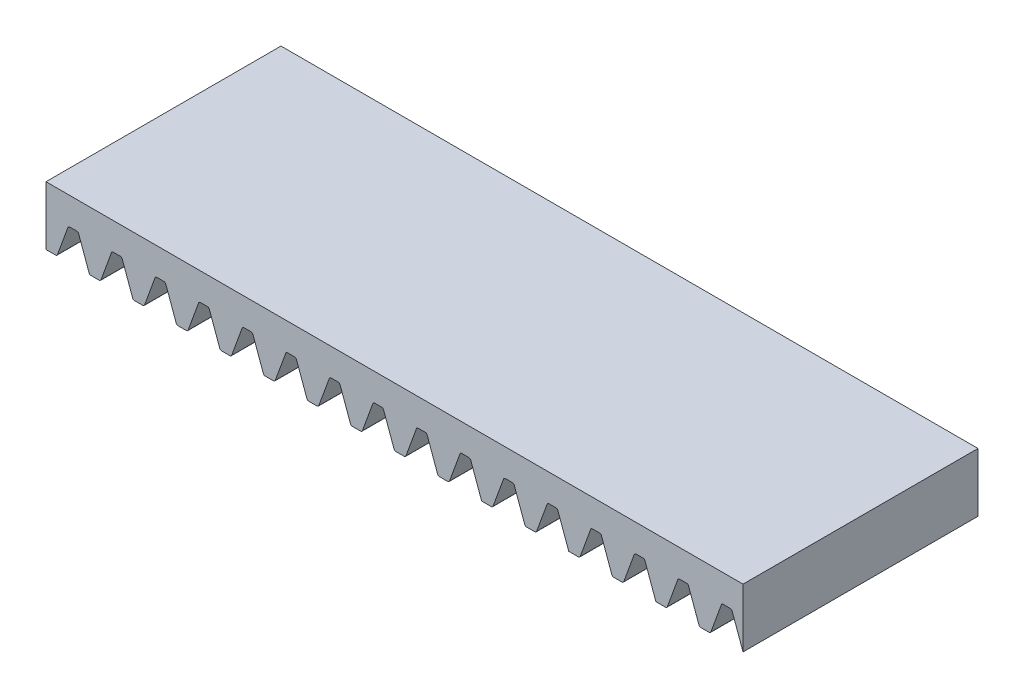
from build123d import *

# Parameters (mm, degrees)
BOSS_EXTRUDE1_DEPTH = 60
FILLET1_R           = 0.5
LPATTERN1_COUNT     = 8
LPATTERN1_PITCH     = 22.2470475
FILLET2_R           = 0.5


with BuildPart() as part:
    # Sketch1 → Boss-Extrude1 (new body)
    with BuildSketch(Plane.XY):
        Polygon((0, 0), (2.8, 0), (5.711761874, 8), (8.211761874, 8), (11.123523748, 0), (13.923523748, 0), (16.835285622, 8), (19.335285622, 8), (22.247047497, 0), (22.247047497, 15), (0, 15), align=None)
    extrude(amount=BOSS_EXTRUDE1_DEPTH)

    # Fillet1
    fillet1_edges = [part.edges().sort_by_distance(p)[0] for p in [
        (19.335285622, 8, 30),
        (16.835285622, 8, 30),
        (13.923523748, 0, 30),
        (2.8, 0, 30),
        (11.123523748, 0, 30),
        (8.211761874, 8, 30),
        (5.711761874, 8, 30),
    ]]
    fillet(fillet1_edges, radius=FILLET1_R)


with BuildPart() as lpattern1_1:
    # LPattern1: pattern copy
    add(part.part.moved(Location(Vector(1, 0, 0) * (1 * LPATTERN1_PITCH))))


with BuildPart() as lpattern1_2:
    # LPattern1: pattern copy
    add(part.part.moved(Location(Vector(1, 0, 0) * (2 * LPATTERN1_PITCH))))


with BuildPart() as lpattern1_3:
    # LPattern1: pattern copy
    add(part.part.moved(Location(Vector(1, 0, 0) * (3 * LPATTERN1_PITCH))))


with BuildPart() as lpattern1_4:
    # LPattern1: pattern copy
    add(part.part.moved(Location(Vector(1, 0, 0) * (4 * LPATTERN1_PITCH))))


with BuildPart() as lpattern1_5:
    # LPattern1: pattern copy
    add(part.part.moved(Location(Vector(1, 0, 0) * (5 * LPATTERN1_PITCH))))


with BuildPart() as lpattern1_6:
    # LPattern1: pattern copy
    add(part.part.moved(Location(Vector(1, 0, 0) * (6 * LPATTERN1_PITCH))))


with BuildPart() as lpattern1_7:
    # LPattern1: pattern copy
    add(part.part.moved(Location(Vector(1, 0, 0) * (7 * LPATTERN1_PITCH))))


with BuildPart() as part_1:
    add(part.part)

    # Combine1: union LPattern1_1, LPattern1_2, LPattern1_3, LPattern1_4, LPattern1_5, LPattern1_6, LPattern1_7
    add(lpattern1_1.part)
    add(lpattern1_2.part)
    add(lpattern1_3.part)
    add(lpattern1_4.part)
    add(lpattern1_5.part)
    add(lpattern1_6.part)
    add(lpattern1_7.part)

    # Fillet2
    fillet2_edges = [part_1.edges().sort_by_distance(p)[0] for p in [
        (88.988189997, 0, 30),
        (66.741142497, 0, 30),
        (44.494094997, 0, 30),
        (22.247047497, 0, 30),
    ]]
    fillet(fillet2_edges, radius=FILLET2_R)


solid = part_1.part
